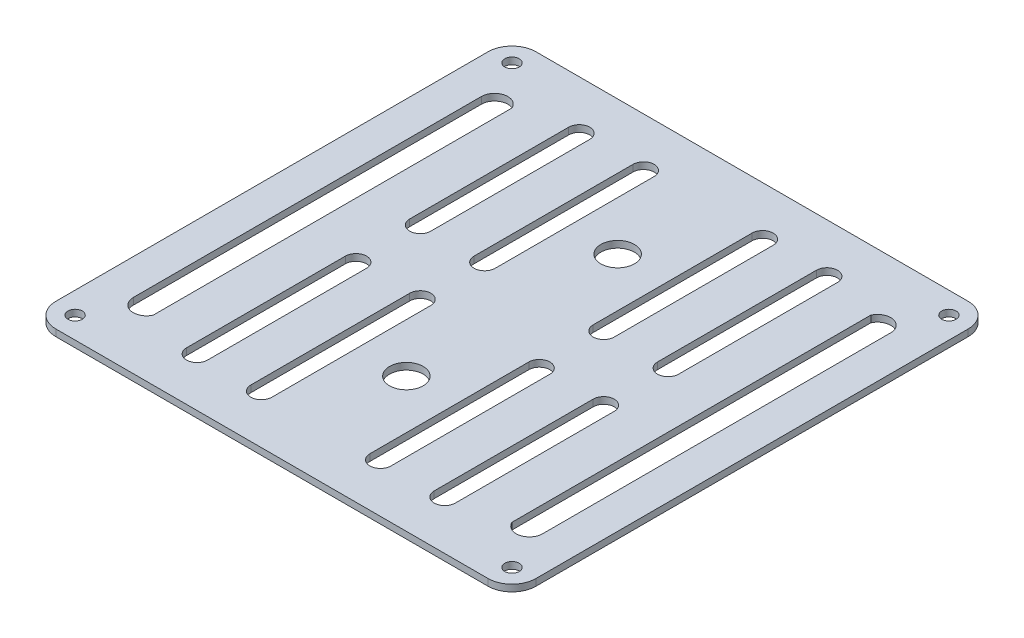
from build123d import *

# Parameters (mm, degrees)
SKETCH1_W           = 100
SKETCH1_H           = 100
SKETCH1_R           = 1.5
SKETCH1_R_2         = 3.5
BOSS_EXTRUDE1_DEPTH = 1.4
FILLET1_R           = 5


with BuildPart() as part:
    # Sketch1 → Boss-Extrude1 (new body)
    with BuildSketch(Plane(origin=(0, 0, 0), x_dir=(1, 0, 0), z_dir=(0, 1, 0))):
        Rectangle(SKETCH1_W, SKETCH1_H)
        with Locations(Location((-45.5, 45.5, 0), (0, 0, 270))):
            Circle(SKETCH1_R, mode=Mode.SUBTRACT)
        with Locations(Location((45.5, 45.5, 0), (0, 0, 270))):
            Circle(SKETCH1_R, mode=Mode.SUBTRACT)
        with Locations(Location((-45.5, -45.5, 0), (0, 0, 270))):
            Circle(SKETCH1_R, mode=Mode.SUBTRACT)
        with Locations(Location((45.5, -45.5, 0), (0, 0, 270))):
            Circle(SKETCH1_R, mode=Mode.SUBTRACT)
        with Locations(Location((0, 22, 0), (0, 0, 270))):
            Circle(SKETCH1_R_2, mode=Mode.SUBTRACT)
        with Locations(Location((0, -22, 0), (0, 0, 270))):
            Circle(SKETCH1_R_2, mode=Mode.SUBTRACT)
        with BuildLine():
            Line((-42.626255843, 36.25), (-42.626255843, -36.25))
            ThreePointArc((-42.626255843, -36.25), (-40.443668748, -38.940825635), (-37.360406683, -37.360406683))
            Line((-37.360406683, -37.360406683), (-37.360406683, 37.360406683))
            ThreePointArc((-37.360406683, 37.360406683), (-40.443668748, 38.940825635), (-42.626255843, 36.25))
        make_face(mode=Mode.SUBTRACT)
        with BuildLine():
            Line((-28, 39.8), (-28, 6.7))
            ThreePointArc((-28, 6.7), (-25.8, 4.5), (-23.6, 6.7))
            Line((-23.6, 6.7), (-23.6, 39.8))
            ThreePointArc((-23.6, 39.8), (-25.8, 42), (-28, 39.8))
        make_face(mode=Mode.SUBTRACT)
        with BuildLine():
            Line((-14.6, 39.8), (-14.6, 6.7))
            ThreePointArc((-14.6, 6.7), (-12.4, 4.5), (-10.2, 6.7))
            Line((-10.2, 6.7), (-10.2, 39.8))
            ThreePointArc((-10.2, 39.8), (-12.4, 42), (-14.6, 39.8))
        make_face(mode=Mode.SUBTRACT)
        with BuildLine():
            Line((-10.2, -39.8), (-10.2, -6.7))
            ThreePointArc((-10.2, -6.7), (-12.4, -4.5), (-14.6, -6.7))
            Line((-14.6, -6.7), (-14.6, -39.8))
            ThreePointArc((-14.6, -39.8), (-12.4, -42), (-10.2, -39.8))
        make_face(mode=Mode.SUBTRACT)
        with BuildLine():
            Line((-23.6, -39.8), (-23.6, -6.7))
            ThreePointArc((-23.6, -6.7), (-25.8, -4.5), (-28, -6.7))
            Line((-28, -6.7), (-28, -39.8))
            ThreePointArc((-28, -39.8), (-25.8, -42), (-23.6, -39.8))
        make_face(mode=Mode.SUBTRACT)
        with BuildLine():
            Line((10.2, -39.8), (10.2, -6.7))
            ThreePointArc((10.2, -6.7), (12.4, -4.5), (14.6, -6.7))
            Line((14.6, -6.7), (14.6, -39.8))
            ThreePointArc((14.6, -39.8), (12.4, -42), (10.2, -39.8))
        make_face(mode=Mode.SUBTRACT)
        with BuildLine():
            Line((10.2, 39.8), (10.2, 6.7))
            ThreePointArc((10.2, 6.7), (12.4, 4.5), (14.6, 6.7))
            Line((14.6, 6.7), (14.6, 39.8))
            ThreePointArc((14.6, 39.8), (12.4, 42), (10.2, 39.8))
        make_face(mode=Mode.SUBTRACT)
        with BuildLine():
            Line((23.6, -39.8), (23.6, -6.7))
            ThreePointArc((23.6, -6.7), (25.8, -4.5), (28, -6.7))
            Line((28, -6.7), (28, -39.8))
            ThreePointArc((28, -39.8), (25.8, -42), (23.6, -39.8))
        make_face(mode=Mode.SUBTRACT)
        with BuildLine():
            Line((23.6, 39.8), (23.6, 6.7))
            ThreePointArc((23.6, 6.7), (25.8, 4.5), (28, 6.7))
            Line((28, 6.7), (28, 39.8))
            ThreePointArc((28, 39.8), (25.8, 42), (23.6, 39.8))
        make_face(mode=Mode.SUBTRACT)
        with BuildLine():
            Line((37.360406683, 37.360406683), (37.360406683, -37.360406683))
            ThreePointArc((37.360406683, -37.360406683), (40.443668748, -38.940825635), (42.626255843, -36.25))
            Line((42.626255843, -36.25), (42.626255843, 36.25))
            ThreePointArc((42.626255843, 36.25), (40.443668748, 38.940825635), (37.360406683, 37.360406683))
        make_face(mode=Mode.SUBTRACT)
    extrude(amount=BOSS_EXTRUDE1_DEPTH)

    # Fillet1
    fillet1_edges = [part.edges().sort_by_distance(p)[0] for p in [
        (-50, 0.7, -50),
        (50, 0.7, -50),
        (50, 0.7, 50),
        (-50, 0.7, 50),
    ]]
    fillet(fillet1_edges, radius=FILLET1_R)


solid = part.part
